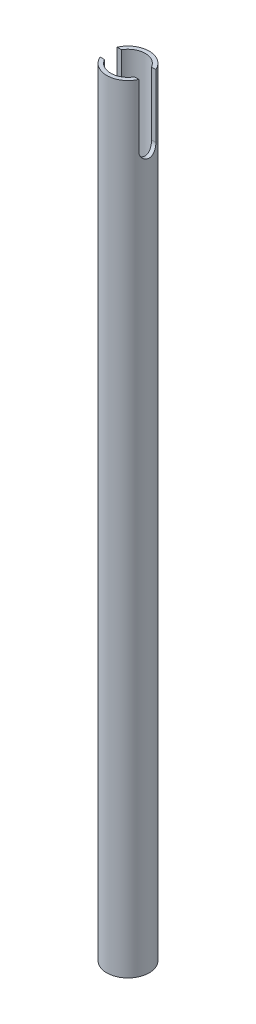
from build123d import *

# Parameters (mm, degrees)
SKETCH1_R               = 7.9375
SKETCH1_R_2             = 6.4643
BOSS_EXTRUDE1_DEPTH     = 291.329005832
CUT_EXTRUDE1_DEPTH      = 292.545189382
CUT_EXTRUDE1_DEPTH_BACK = 292.545189382


with BuildPart() as part:
    # Sketch1 → Boss-Extrude1 (new body)
    with BuildSketch(Plane(origin=(0, 0, 0), x_dir=(1, 0, 0), z_dir=(0, 1, 0))):
        with Locations(Location((0, 0, 0), (0, 0, 180))):
            Circle(SKETCH1_R)
        with Locations(Location((0, 0, 0), (0, 0, 180))):
            Circle(SKETCH1_R_2, mode=Mode.SUBTRACT)
    extrude(amount=BOSS_EXTRUDE1_DEPTH)

    # Sketch4 → Cut-Extrude1 (cut, two sides: drawn at the far end of the back side and taken through both)
    with BuildSketch(Plane(origin=(0, 0, 0), x_dir=(0, 0, -1), z_dir=(1, 0, 0)).offset(-CUT_EXTRUDE1_DEPTH_BACK)):
        with BuildLine():
            Line((3.175, 318.491978033), (3.175, 267.691978033))
            ThreePointArc((3.175, 267.691978033), (0, 264.516978033), (-3.175, 267.691978033))
            Line((-3.175, 267.691978033), (-3.175, 318.491978033))
            ThreePointArc((-3.175, 318.491978033), (0, 321.666978033), (3.175, 318.491978033))
        make_face()
    extrude(amount=CUT_EXTRUDE1_DEPTH + CUT_EXTRUDE1_DEPTH_BACK, mode=Mode.SUBTRACT)


solid = part.part
